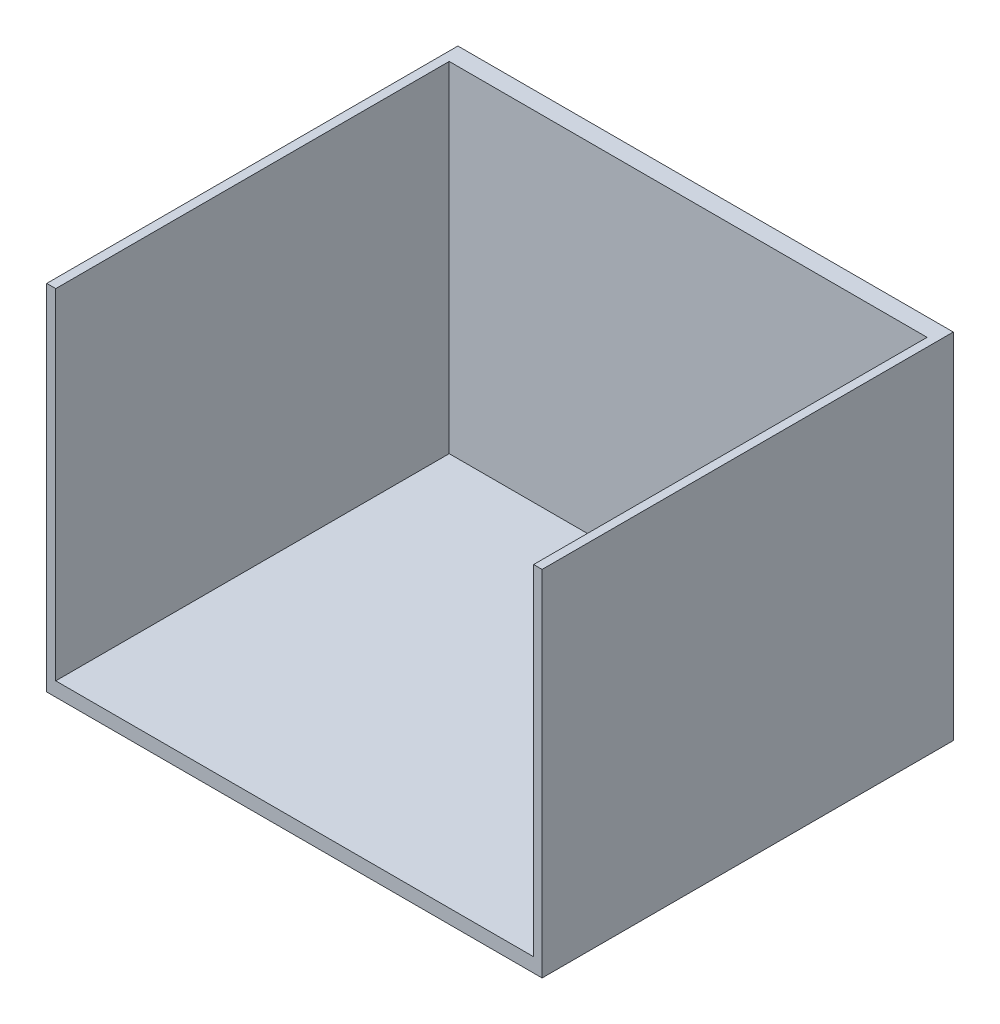
from build123d import *

# Parameters (mm, degrees)
SKETCH1_W           = 88.9
SKETCH1_H           = 63.5
BOSS_EXTRUDE1_DEPTH = 3.175
SKETCH4_W           = 1.617754759
SKETCH4_H           = 63.5
BOSS_EXTRUDE2_DEPTH = 70.612
SKETCH5_W           = 1.524
SKETCH5_H           = 63.5
BOSS_EXTRUDE3_DEPTH = 70.612
SKETCH6_W           = 88.9
SKETCH6_H           = 73.787
BOSS_EXTRUDE4_DEPTH = 2.54


with BuildPart() as part:
    # Sketch1 → Boss-Extrude1 (new body)
    with BuildSketch(Plane.XY):
        with Locations((11.755371901, -15.035330579)):
            Rectangle(SKETCH1_W, SKETCH1_H)
    extrude(amount=BOSS_EXTRUDE1_DEPTH)

    # Sketch4 → Boss-Extrude2 (add)
    with BuildSketch(Plane.XY.offset(3.175)):
        with Locations((-31.88575072, -15.035330579)):
            Rectangle(SKETCH4_W, SKETCH4_H)
    extrude(amount=BOSS_EXTRUDE2_DEPTH)

    # Sketch5 → Boss-Extrude3 (add)
    with BuildSketch(Plane.XY.offset(3.175)):
        with Locations((55.443371901, -15.035330579)):
            Rectangle(SKETCH5_W, SKETCH5_H)
    extrude(amount=BOSS_EXTRUDE3_DEPTH)

    # Sketch6 → Boss-Extrude4 (add)
    with BuildSketch(Plane.XZ.offset(46.785330579)):
        with Locations((11.755371901, 36.8935)):
            Rectangle(SKETCH6_W, SKETCH6_H)
    extrude(amount=-BOSS_EXTRUDE4_DEPTH)


solid = part.part
